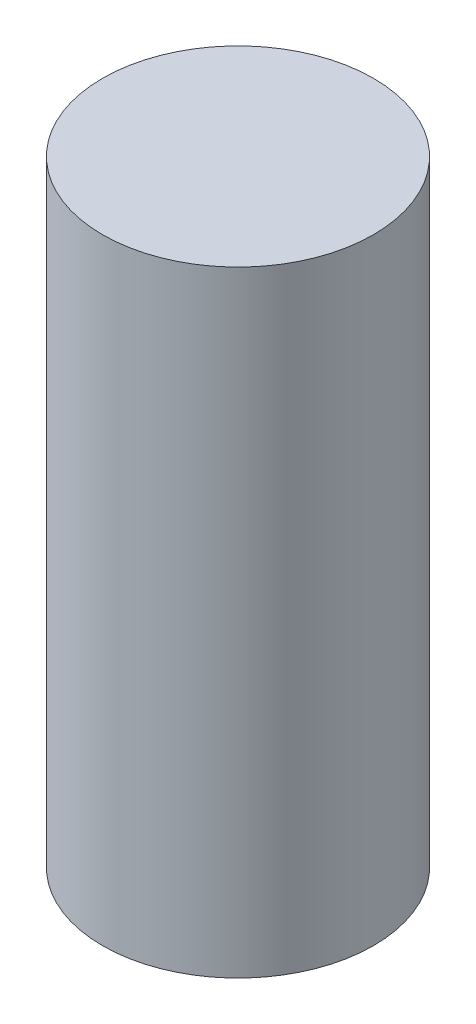
from build123d import *

# Parameters (mm, degrees)
SKETCH2_R           = 11
BOSS_EXTRUDE1_DEPTH = 50


with BuildPart() as part:
    # Sketch2 → Boss-Extrude1 (new body)
    with BuildSketch(Plane(origin=(0, 0, 0), x_dir=(1, 0, 0), z_dir=(0, 1, 0))):
        with Locations(Location((0, 0, 0), (0, 0, 270))):
            Circle(SKETCH2_R)
    extrude(amount=BOSS_EXTRUDE1_DEPTH)


solid = part.part
